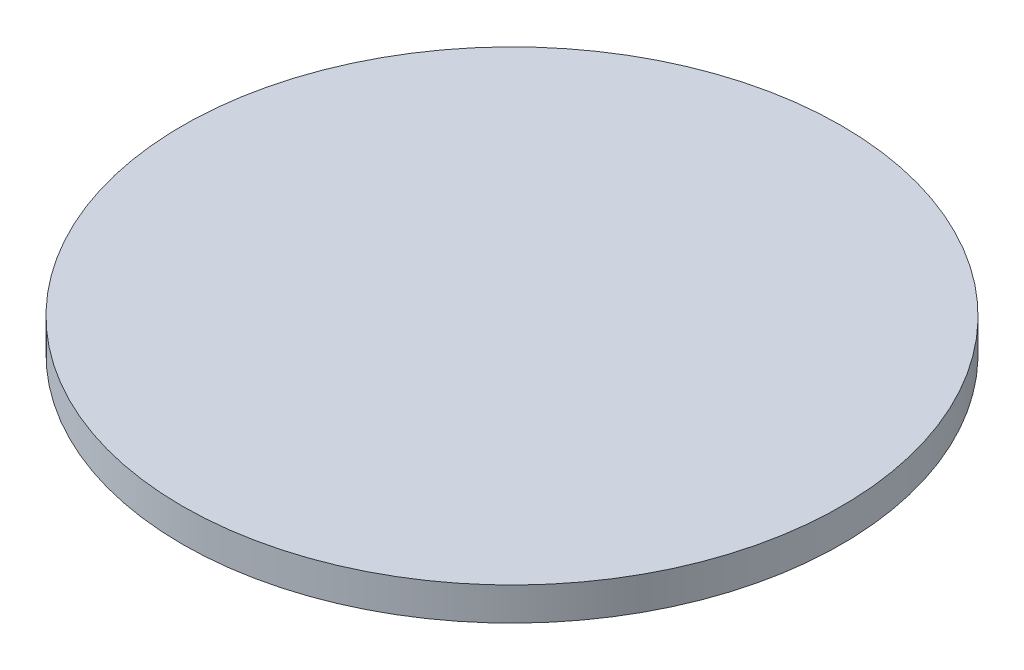
from build123d import *

# Parameters (mm, degrees)
SKETCH1_R           = 31.75
BOSS_EXTRUDE1_DEPTH = 3.18


with BuildPart() as part:
    # Sketch1 → Boss-Extrude1 (new body)
    with BuildSketch(Plane(origin=(0, 0, 0), x_dir=(1, 0, 0), z_dir=(0, 1, 0))):
        with Locations(Location((0, 0, 0), (0, 0, 90))):
            Circle(SKETCH1_R)
    extrude(amount=BOSS_EXTRUDE1_DEPTH)


solid = part.part
